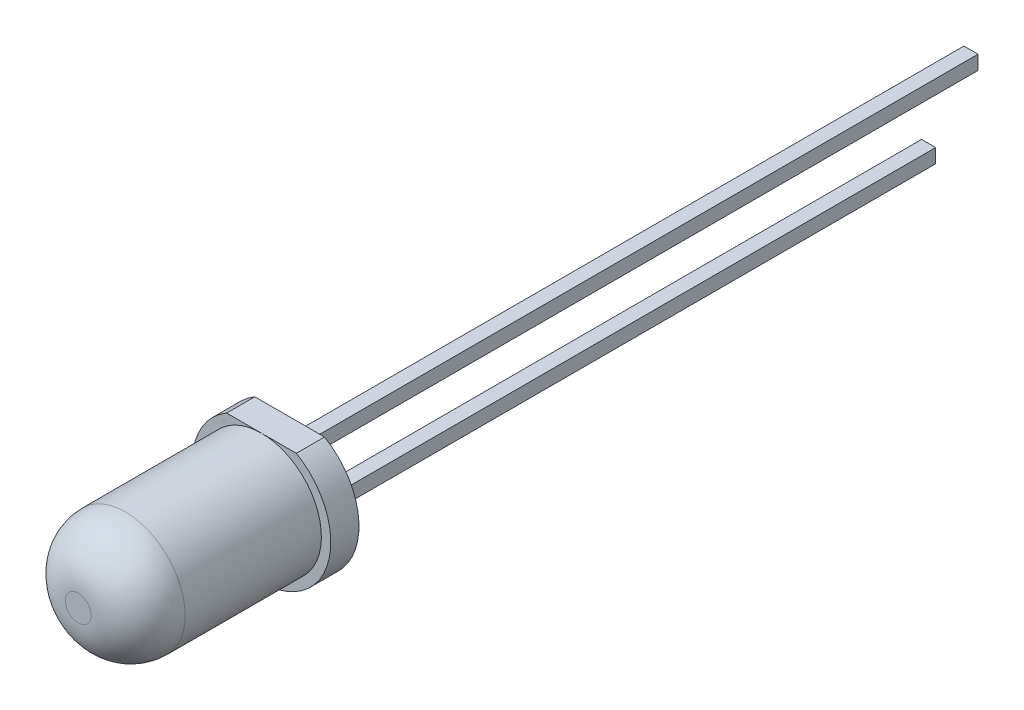
from build123d import *

# Parameters (mm, degrees)
SZKIC2_R                         = 2.95
DODANIE_WYCI_GNI_CIE1_DEPTH      = 1.2
SZKIC3_R                         = 2.55
DODANIE_WYCI_GNI_CIE2_DEPTH      = 7.8
ZAOKR_GLENIE2_R                  = 2
SZKIC4_W                         = 4.283554882
SZKIC4_H                         = 0.750281293
WYTNIJ_WYCI_GNI_CIE1_DEPTH       = 7.8
DODANIE_WYCI_GNI_CIE5_DEPTH      = 0.25
DODANIE_WYCI_GNI_CIE5_DEPTH_BACK = 0.25
SZKIC6_W                         = 0.2
SZKIC6_H                         = 1
SZKIC7_W                         = 0.6
SZKIC7_H                         = 0.6
DODANIE_WYCI_GNI_CIE6_DEPTH      = 29
SZKIC8_W                         = 0.861364308
SZKIC8_H                         = 0.90651153
WYTNIJ_WYCI_GNI_CIE2_DEPTH       = 1.8


with BuildPart() as part:
    # Szkic2 → Dodanie-wyciągnięcie1 (new body)
    with BuildSketch(Plane.XY):
        Circle(SZKIC2_R)
    extrude(amount=DODANIE_WYCI_GNI_CIE1_DEPTH)

    # Szkic3 → Dodanie-wyciągnięcie2 (add)
    with BuildSketch(Plane.XY.offset(1.2)):
        Circle(SZKIC3_R)
    extrude(amount=DODANIE_WYCI_GNI_CIE2_DEPTH)

    # Zaokrąglenie2
    zaokr_glenie2_edges = [part.edges().sort_by_distance(p)[0] for p in [
        (-2.55, 0, 9),
    ]]
    fillet(zaokr_glenie2_edges, radius=ZAOKR_GLENIE2_R)

    # Szkic4 → Wytnij-wyciągnięcie1 (cut)
    with BuildSketch(Plane.XY.offset(1.2)):
        with Locations((0, 2.925140647)):
            Rectangle(SZKIC4_W, SZKIC4_H)
    extrude(amount=-WYTNIJ_WYCI_GNI_CIE1_DEPTH, mode=Mode.SUBTRACT)

    # Szkic7 → Dodanie-wyciągnięcie6 (add)
    with BuildSketch(Plane(origin=(0, 0, 0), x_dir=(-1, 0, 0), z_dir=(0, 0, -1))):
        with Locations((0, 1.27)):
            Rectangle(SZKIC7_W, SZKIC7_H)
        with Locations((0, -1.27)):
            Rectangle(SZKIC7_W, SZKIC7_H)
    extrude(amount=DODANIE_WYCI_GNI_CIE6_DEPTH)

    # Szkic8 → Wytnij-wyciągnięcie2 (cut)
    with BuildSketch(Plane(origin=(0, 0, -29), x_dir=(-1, 0, 0), z_dir=(0, 0, -1))):
        with Locations((0, -1.265005497)):
            Rectangle(SZKIC8_W, SZKIC8_H)
    extrude(amount=-WYTNIJ_WYCI_GNI_CIE2_DEPTH, mode=Mode.SUBTRACT)


with BuildPart() as body_2:
    # Szkic6 → Dodanie-wyciągnięcie5 (new, two sides: drawn at the far end of the back side and taken through both)
    with BuildSketch(Plane(origin=(0, 0, 0), x_dir=(0, 0, -1), z_dir=(1, 0, 0)).offset(-DODANIE_WYCI_GNI_CIE5_DEPTH_BACK)):
        with Locations((-3.2, 0)):
            Rectangle(SZKIC6_W, SZKIC6_H)
    extrude(amount=DODANIE_WYCI_GNI_CIE5_DEPTH + DODANIE_WYCI_GNI_CIE5_DEPTH_BACK)


solid = Compound([part.part, body_2.part])
